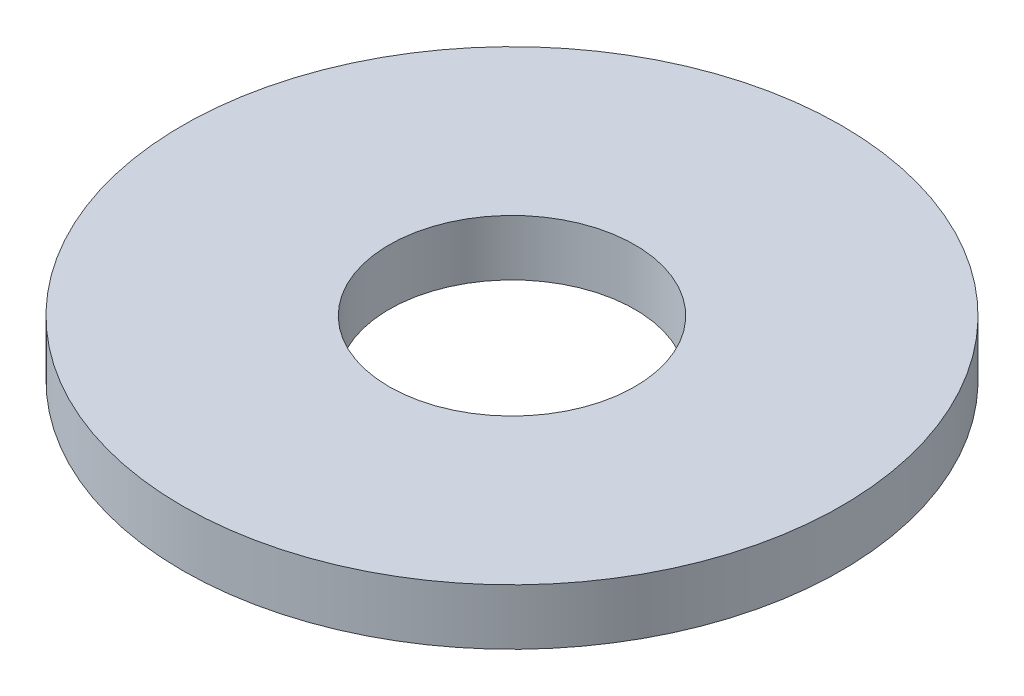
from build123d import *

# Parameters (mm, degrees)
SKETCH1_R           = 5.9
SKETCH1_R_2         = 2.2
BOSS_EXTRUDE1_DEPTH = 1


with BuildPart() as part:
    # Sketch1 → Boss-Extrude1 (new body)
    with BuildSketch(Plane(origin=(0, 0, 0), x_dir=(1, 0, 0), z_dir=(0, 1, 0))):
        with Locations(Location((0, 0, 0), (0, 0, 270))):
            Circle(SKETCH1_R)
        with Locations(Location((0, 0, 0), (0, 0, 270))):
            Circle(SKETCH1_R_2, mode=Mode.SUBTRACT)
    extrude(amount=BOSS_EXTRUDE1_DEPTH)


solid = part.part
